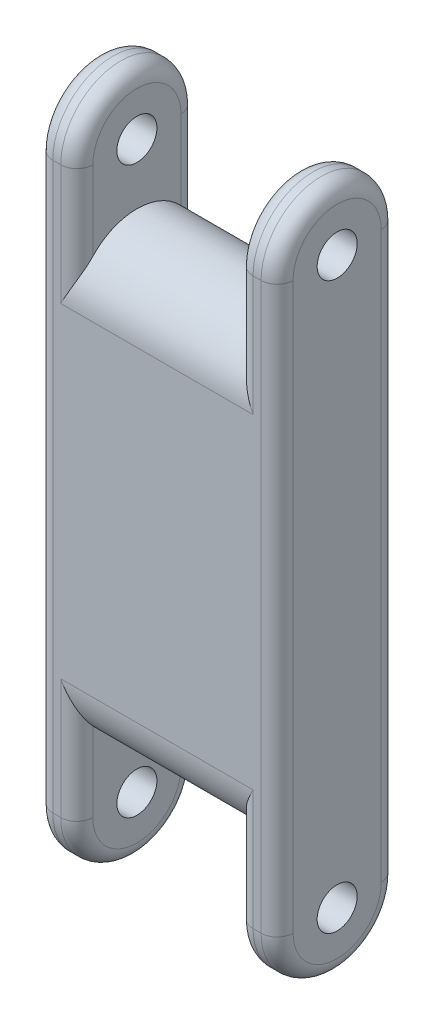
from build123d import *

# Parameters (mm, degrees)
BOSS_EXTRUDE1_DEPTH = 19.05
SKETCH2_R           = 1.5875
SKETCH2_R_2         = 1.5874999999999988
CUT_EXTRUDE1_DEPTH  = 19.05
CUT_EXTRUDE2_DEPTH  = 6.35
FILLET1_R           = 1.27
SKETCH3_R           = 1.3523393116529026
BOSS_EXTRUDE2_DEPTH = 2.54
FILLET2_R           = 0.762
SKETCH4_R           = 0.6365323226185287
CUT_EXTRUDE3_DEPTH  = 50.150613196033525


with BuildPart() as part:
    # Sketch1 → Boss-Extrude1 (new body)
    with BuildSketch(Plane(origin=(0, 0, 0), x_dir=(0, 0, -1), z_dir=(1, 0, 0))):
        with BuildLine():
            Line((-4.7625, 0), (-4.7625, 44.8056))
            ThreePointArc((-4.7625, 44.8056), (2.9e-16, 49.5681), (4.7625, 44.8056))
            Line((4.7625, 44.8056), (4.762500000000005, 5.8e-16))
            ThreePointArc((4.762500000000005, 5.8e-16), (1.35e-15, -4.762500000000005), (-4.7625, 0))
        make_face()
    extrude(amount=BOSS_EXTRUDE1_DEPTH)

    # Sketch2 → Cut-Extrude1 (cut)
    with BuildSketch(Plane(origin=(19.05, 0, 0), x_dir=(0, 0, -1), z_dir=(1, 0, 0))):
        Circle(SKETCH2_R)
        with Locations((0, 44.8056)):
            Circle(SKETCH2_R_2)
    extrude(amount=-CUT_EXTRUDE1_DEPTH, mode=Mode.SUBTRACT)

    # 3DSketch1 → Cut-Extrude2 (cut, symmetric)
    with BuildSketch(Plane(origin=(9.524999999999954, 44.80559999999997, -4.762500000000004), x_dir=(0, -0.9781419365644765, 0.20793833685469326), z_dir=(-1, -9.3e-16, 3.6e-16))):
        with BuildLine():
            Line((0, 0), (9.316801945776646, -1.9806126585409503))
            ThreePointArc((9.316801945776646, -1.9806126585409503), (5.6487073021588, 3.668094643617845), (11.2974146043176, 7.336189287235693))
            Line((11.2974146043176, 7.336189287235693), (1.9806126585409412, 9.316801945776648))
            ThreePointArc((1.9806126585409412, 9.316801945776648), (-3.6680946436178474, 5.648707302158794), (0, 0))
        make_face()
        with BuildLine():
            Line((45.806849011474235, 0), (36.49004706569759, 1.980612658540955))
            ThreePointArc((36.49004706569759, 1.980612658540955), (40.15814170931544, -3.668094643617836), (34.50943440715664, -7.336189287235687))
            Line((34.50943440715664, -7.336189287235687), (43.82623635293327, -9.316801945776637))
            ThreePointArc((43.82623635293327, -9.316801945776637), (49.47494365509206, -5.648707302158793), (45.806849011474235, 0))
        make_face()
    extrude(amount=CUT_EXTRUDE2_DEPTH, both=True, mode=Mode.SUBTRACT)

    # Fillet1
    fillet1_edges = [part.edges().sort_by_distance(p)[0] for p in [
        (19.05, 49.5681, 7e-17),
        (19.05, 22.4028, 4.7625),
        (15.874999999999961, 40.04309999999998, 4.762500000000003),
        (15.874999999999957, 40.043099999999974, -4.762500000000005),
        (3.174999999999959, 40.04309999999996, -4.762499999999999),
        (3.1749999999999625, 40.04309999999997, 4.762500000000008),
        (19.05, -4.762500000000005, -2.98e-15),
        (0, 22.4028, 4.7625),
        (0, 49.5681, 7e-17),
        (15.874999999999995, 4.762500000000003, 4.762499999999996),
        (15.874999999999991, 4.762500000000003, -4.762500000000006),
        (3.1749999999999954, 4.762499999999989, 4.762500000000001),
        (3.174999999999992, 4.762499999999989, -4.762500000000001),
        (0, 22.4028, -4.762500000000003),
        (0, -4.762500000000005, -2.98e-15),
        (19.05, 22.4028, -4.762500000000003),
    ]]
    fillet(fillet1_edges, radius=FILLET1_R)

    # Sketch3 → Boss-Extrude2 (add)
    with BuildSketch(Plane.ZY):
        with Locations((-2.068463746823568, 42.49092897757123)):
            Circle(SKETCH3_R)
    extrude(amount=BOSS_EXTRUDE2_DEPTH)

    # Fillet2
    fillet2_edges = [part.edges().sort_by_distance(p)[0] for p in [
        (-2.54, 42.49092897757123, -3.42080305847647),
    ]]
    fillet(fillet2_edges, radius=FILLET2_R)

    # Sketch4 → Cut-Extrude3 (cut, through all)
    with BuildSketch(Plane(origin=(0, 10.403230824440865, 18.01892435079848), x_dir=(-1, 0, 0), z_dir=(0, 0.49999999999999484, 0.8660254037844416))):
        with Locations(Location((0.8782218587697344, -37.93359892462922, 0), (0, 0, 90))):
            Circle(SKETCH4_R)
    extrude(amount=-CUT_EXTRUDE3_DEPTH, mode=Mode.SUBTRACT)


solid = part.part
